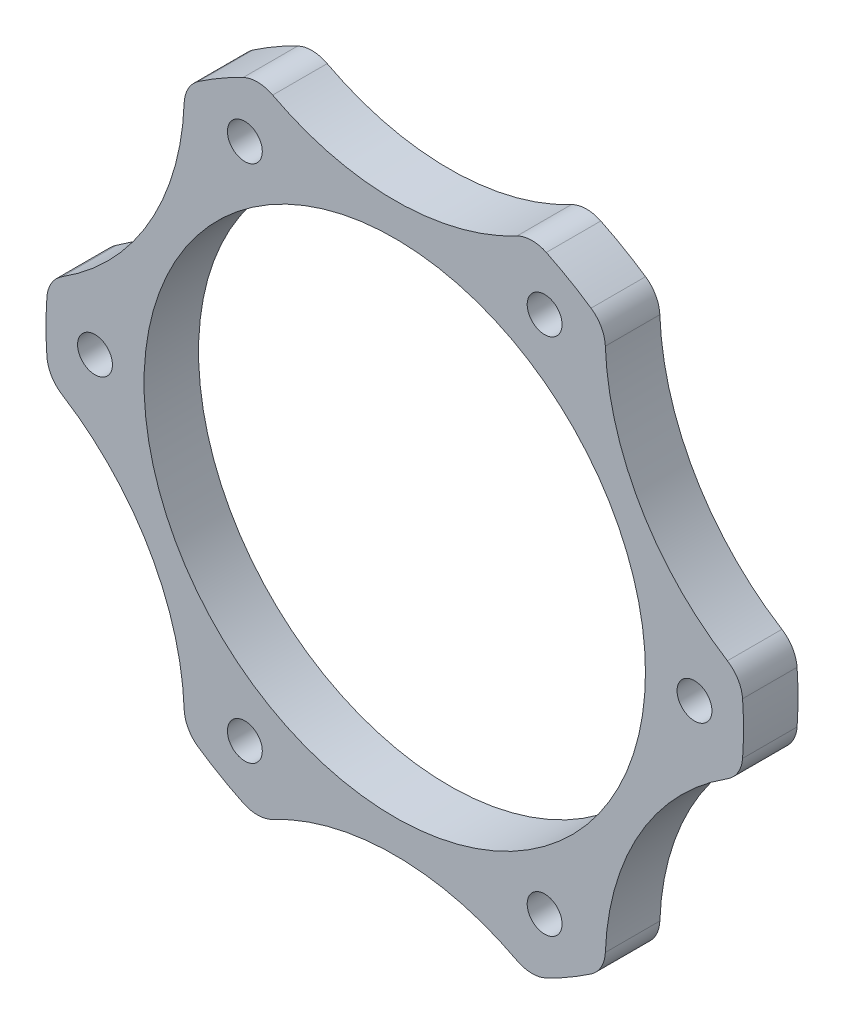
from build123d import *

# Parameters (mm, degrees)
SKETCH_1_R               = 32
SKETCH_1_R_2             = 23
EXTRUDE_1_DEPTH          = 5
SKETCH_2_R               = 24
CUT_EXTRUDE_1_DEPTH      = 10
PATTERN_CIRCULAR_1_COUNT = 6
SKETCH_3_R               = 1.6
CUT_EXTRUDE_2_DEPTH      = 10
PATTERN_CIRCULAR_2_COUNT = 6
FILLET_1_R               = 3


with BuildPart() as part:
    # 草图1 → 凸台-拉伸1 (new body)
    with BuildSketch(Plane.XY):
        Circle(SKETCH_1_R)
        Circle(SKETCH_1_R_2, mode=Mode.SUBTRACT)
    extrude(amount=EXTRUDE_1_DEPTH)

    # 草图2 → 切除-拉伸1 (cut)
    with BuildSketch(Plane.XY.offset(5)):
        with Locations((0, 50)):
            Circle(SKETCH_2_R)
    cut_extrude_1 = extrude(amount=-CUT_EXTRUDE_1_DEPTH, mode=Mode.SUBTRACT)

    # 阵列(圆周)1: 切除-拉伸1 ×6 about axis
    pattern_circular_1_axis = Axis((0, 0, 0), (0, 0, 1))
    for i in range(1, PATTERN_CIRCULAR_1_COUNT):
        add(cut_extrude_1.rotate(pattern_circular_1_axis, i * 360 / PATTERN_CIRCULAR_1_COUNT), mode=Mode.SUBTRACT)

    # 草图3 → 切除-拉伸2 (cut)
    with BuildSketch(Plane.XY.offset(5)):
        with Locations((13.75, 23.815698604)):
            Circle(SKETCH_3_R)
    cut_extrude_2 = extrude(amount=-CUT_EXTRUDE_2_DEPTH, mode=Mode.SUBTRACT)

    # 阵列(圆周)2: 切除-拉伸2 ×6 about axis
    pattern_circular_2_axis = Axis((0, 0, 0), (0, 0, 1))
    for i in range(1, PATTERN_CIRCULAR_2_COUNT):
        add(cut_extrude_2.rotate(pattern_circular_2_axis, i * 360 / PATTERN_CIRCULAR_2_COUNT), mode=Mode.SUBTRACT)

    # 圆角1
    fillet_1_edges = [part.edges().sort_by_distance(p)[0] for p in [
        (-12.447071945, 29.48, 2.5),
        (12.447071945, 29.48, 2.5),
        (-31.753964876, 3.960519493, 2.5),
        (-19.306892931, 25.519480507, 2.5),
        (19.306892931, 25.519480507, 2.5),
        (31.753964876, 3.960519493, 2.5),
        (31.753964876, -3.960519493, 2.5),
        (19.306892931, -25.519480507, 2.5),
        (-19.306892931, -25.519480507, 2.5),
        (-31.753964876, -3.960519493, 2.5),
        (12.447071945, -29.48, 2.5),
        (-12.447071945, -29.48, 2.5),
    ]]
    fillet(fillet_1_edges, radius=FILLET_1_R)


solid = part.part
